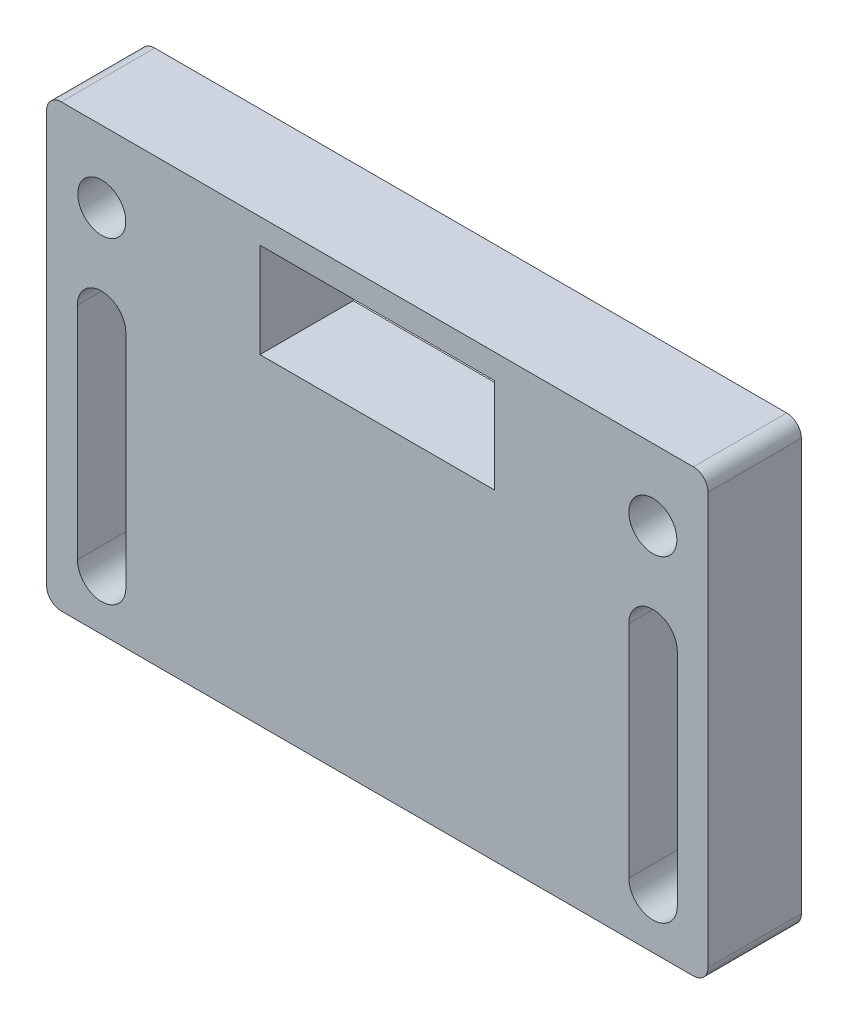
from build123d import *

# Parameters (mm, degrees)
SKETCH1_W                                        = 90
SKETCH1_H                                        = 60
BOSS_EXTRUDE1_DEPTH                              = 12.7
CSK_FOR_1_4_FLAT_HEAD_MACHINE_SCREW1_D           = 6.5278
CSK_FOR_1_4_FLAT_HEAD_MACHINE_SCREW1_CSINK_D     = 12.8778
CSK_FOR_1_4_FLAT_HEAD_MACHINE_SCREW1_CSINK_ANGLE = 82
FILLET1_R                                        = 2
CUT_EXTRUDE1_DEPTH                               = 109.909549627


with BuildPart() as part:
    # Sketch1 → Boss-Extrude1 (new body)
    with BuildSketch(Plane.XY):
        with Locations((45, -30)):
            Rectangle(SKETCH1_W, SKETCH1_H)
        Polygon((29.025, -3.367091904), (29.025, -16.267091904), (60.975, -16.267091904), (60.975, -3.367091904), (45, -3.367091904), align=None, mode=Mode.SUBTRACT)
    extrude(amount=BOSS_EXTRUDE1_DEPTH)

    # CSK for 1/4 Flat Head Machine Screw1 (through all)
    with Locations(Plane(origin=(0, 0, 0), x_dir=(-1, 0, 0), z_dir=(0, 0, -1))):
        with Locations((-82.49, -9.717091904), (-7.51, -9.717091904)):
            CounterSinkHole(CSK_FOR_1_4_FLAT_HEAD_MACHINE_SCREW1_D / 2, CSK_FOR_1_4_FLAT_HEAD_MACHINE_SCREW1_CSINK_D / 2, counter_sink_angle=CSK_FOR_1_4_FLAT_HEAD_MACHINE_SCREW1_CSINK_ANGLE)

    # Fillet1
    fillet1_edges = [part.edges().sort_by_distance(p)[0] for p in [
        (0, 0, 6.35),
        (90, 0, 6.35),
        (90, -60, 6.35),
        (0, -60, 6.35),
    ]]
    fillet(fillet1_edges, radius=FILLET1_R)

    # Sketch5 → Cut-Extrude1 (cut, through all)
    with BuildSketch(Plane(origin=(0, 0, 0), x_dir=(-1, 0, 0), z_dir=(0, 0, -1))):
        with BuildLine():
            Line((-10.785, -22.847364981), (-10.785, -52.847364981))
            ThreePointArc((-10.785, -52.847364981), (-7.485, -56.147364981), (-4.185, -52.847364981))
            Line((-4.185, -52.847364981), (-4.185, -22.847364981))
            ThreePointArc((-4.185, -22.847364981), (-7.485, -19.547364981), (-10.785, -22.847364981))
        make_face()
        with BuildLine():
            Line((-79.215, -52.847364981), (-79.215, -22.847364981))
            ThreePointArc((-79.215, -22.847364981), (-82.515, -19.547364981), (-85.815, -22.847364981))
            Line((-85.815, -22.847364981), (-85.815, -52.847364981))
            ThreePointArc((-85.815, -52.847364981), (-82.515, -56.147364981), (-79.215, -52.847364981))
        make_face()
    extrude(amount=-CUT_EXTRUDE1_DEPTH, mode=Mode.SUBTRACT)


solid = part.part
